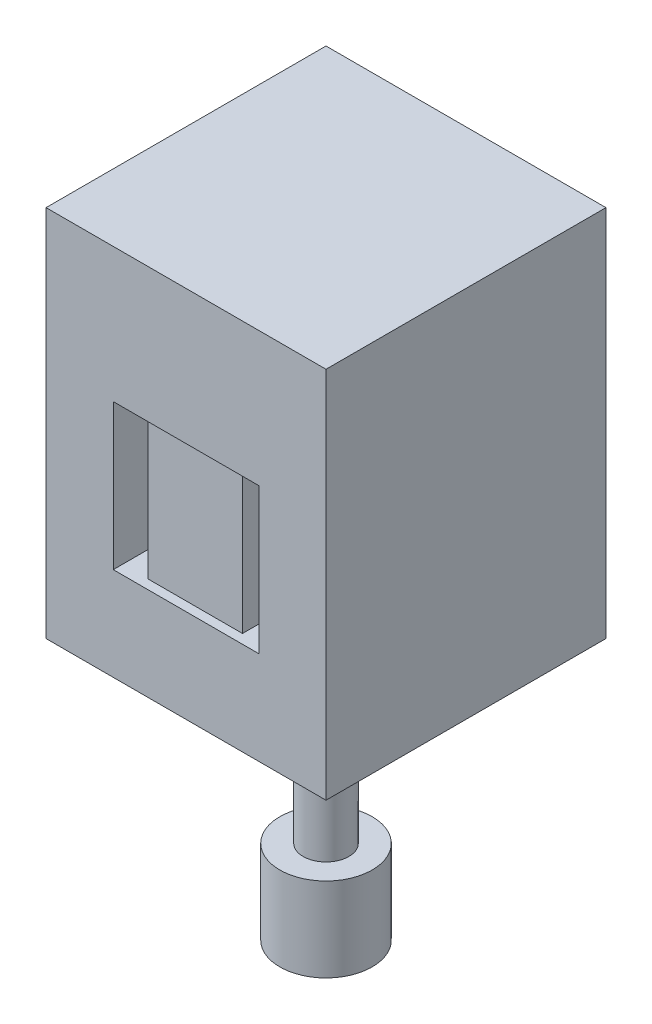
from build123d import *

# Parameters (mm, degrees)
SKETCH_1_W          = 30
SKETCH_1_H          = 30
EXTRUDE_1_DEPTH     = 40
SKETCH_2_R          = 2.45
EXTRUDE_2_DEPTH     = 19
SKETCH_3_R          = 4.95
EXTRUDE_3_DEPTH     = 9
SKETCH_4_W          = 15.6
SKETCH_4_H          = 15.6
CUT_EXTRUDE_1_DEPTH = 1
SKETCH_5_W          = 2.75
SKETCH_5_H          = 15.6
CUT_EXTRUDE_2_DEPTH = 3
FILLET_1_R          = 3


with BuildPart() as part:
    # 草图1 → 凸台-拉伸1 (new body)
    with BuildSketch(Plane(origin=(0, 0, 0), x_dir=(1, 0, 0), z_dir=(0, 1, 0))):
        Rectangle(SKETCH_1_W, SKETCH_1_H)
    extrude(amount=EXTRUDE_1_DEPTH)

    # 草图2 → 凸台-拉伸2 (add)
    with BuildSketch(Plane.XZ):
        with Locations(Location((0, 0, 0), (0, 0, 270))):
            Circle(SKETCH_2_R)
    extrude(amount=EXTRUDE_2_DEPTH)

    # 草图3 → 凸台-拉伸3 (add)
    with BuildSketch(Plane.XZ.offset(19)):
        with Locations(Location((0, 0, 0), (0, 0, 270))):
            Circle(SKETCH_3_R)
    extrude(amount=EXTRUDE_3_DEPTH)

    # 草图4 → 切除-拉伸1 (cut)
    with BuildSketch(Plane.XY.offset(15)):
        with Locations((0, 17.8)):
            Rectangle(SKETCH_4_W, SKETCH_4_H)
    extrude(amount=-CUT_EXTRUDE_1_DEPTH, mode=Mode.SUBTRACT)

    # 草图5 → 切除-拉伸2 (cut)
    with BuildSketch(Plane.XY.offset(14)):
        with Locations((-6.425, 17.8)):
            Rectangle(SKETCH_5_W, SKETCH_5_H)
        with Locations((6.425, 17.8)):
            Rectangle(SKETCH_5_W, SKETCH_5_H)
    extrude(amount=-CUT_EXTRUDE_2_DEPTH, mode=Mode.SUBTRACT)

    # 圆角1
    fillet_1_edges = [part.edges().sort_by_distance(p)[0] for p in [
        (0, 0, 2.45),
    ]]
    fillet(fillet_1_edges, radius=FILLET_1_R)


solid = part.part
